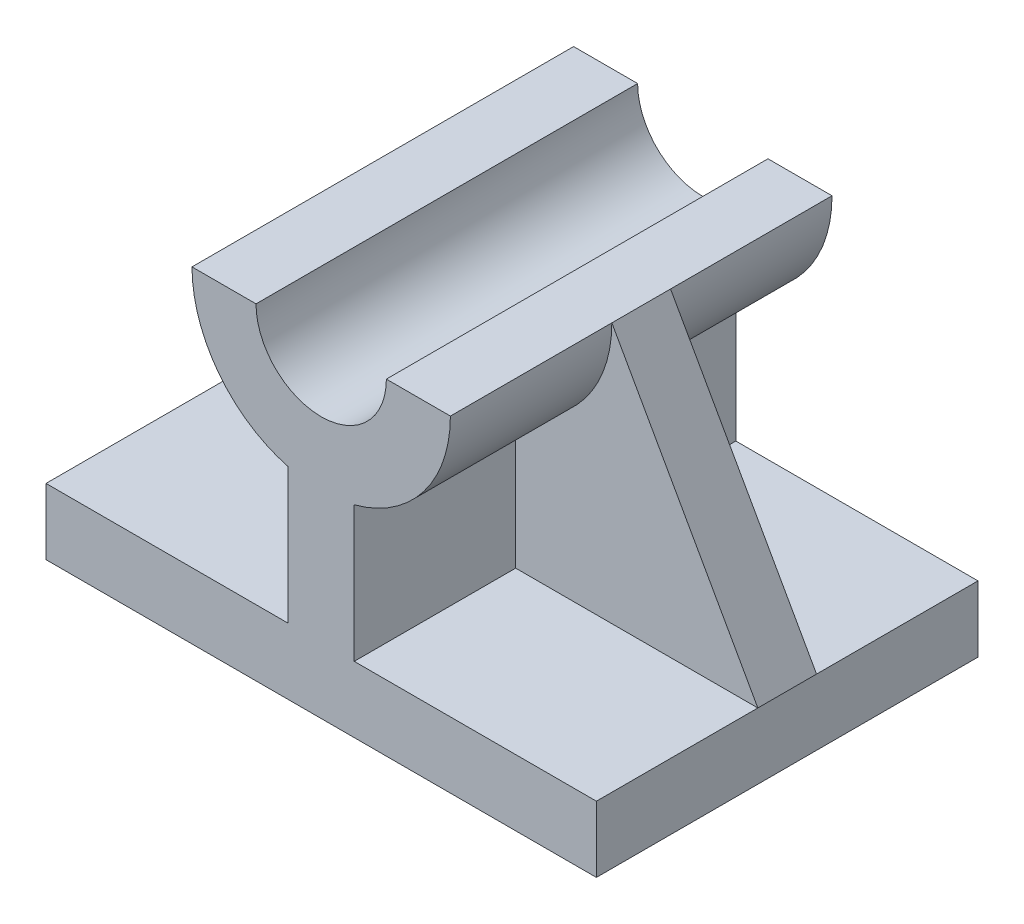
from build123d import *

# Parameters (mm, degrees)
BOSS_EXTRUDE5_DEPTH      = 26
BOSS_EXTRUDE5_DEPTH_BACK = 26
RIB1_REACH               = 62.682
SKETCH8_WALL_W           = 164.057376466
SKETCH8_WALL_H           = 8


with BuildPart() as part:
    # Sketch7 → Boss-Extrude5 (new, two sides: drawn at the far end of the back side and taken through both)
    with BuildSketch(Plane.XY.offset(-BOSS_EXTRUDE5_DEPTH_BACK)):
        with BuildLine():
            Line((-17.60590988, 40), (-8.880775936, 40))
            ThreePointArc((-8.880775936, 40), (0, 31.119224064), (8.880775936, 40))
            Line((8.880775936, 40), (17.60590988, 40))
            ThreePointArc((17.60590988, 40), (13.949814643, 29.258923046), (4.5, 22.978893611))
            Line((4.5, 22.978893611), (4.5, 4.5))
            Line((4.5, 4.5), (37.5, 4.5))
            Line((37.5, 4.5), (37.5, -4.5))
            Line((37.5, -4.5), (-37.5, -4.5))
            Line((-37.5, -4.5), (-37.5, 4.5))
            Line((-37.5, 4.5), (-4.5, 4.5))
            Line((-4.5, 4.5), (-4.5, 22.978893611))
            ThreePointArc((-4.5, 22.978893611), (-13.949814643, 29.258923046), (-17.60590988, 40))
        make_face()
    extrude(amount=BOSS_EXTRUDE5_DEPTH + BOSS_EXTRUDE5_DEPTH_BACK)

    # Sketch8 wall → Rib1 (add, up to next)
    with BuildSketch(Plane(origin=(27.55295494, 22.25, 0), x_dir=(0.488866930082, -0.872358369406, 0), z_dir=(0.872358369406, 0.488866930082, 0)), mode=Mode.PRIVATE) as rib1_sk1:
        Rectangle(SKETCH8_WALL_W, SKETCH8_WALL_H)
    rib1_tool1 = extrude(rib1_sk1.sketch, amount=-RIB1_REACH, mode=Mode.PRIVATE) - part.part
    add(rib1_tool1.solids().sort_by_distance((27.55295494, 22.25, 0))[0])


solid = part.part
